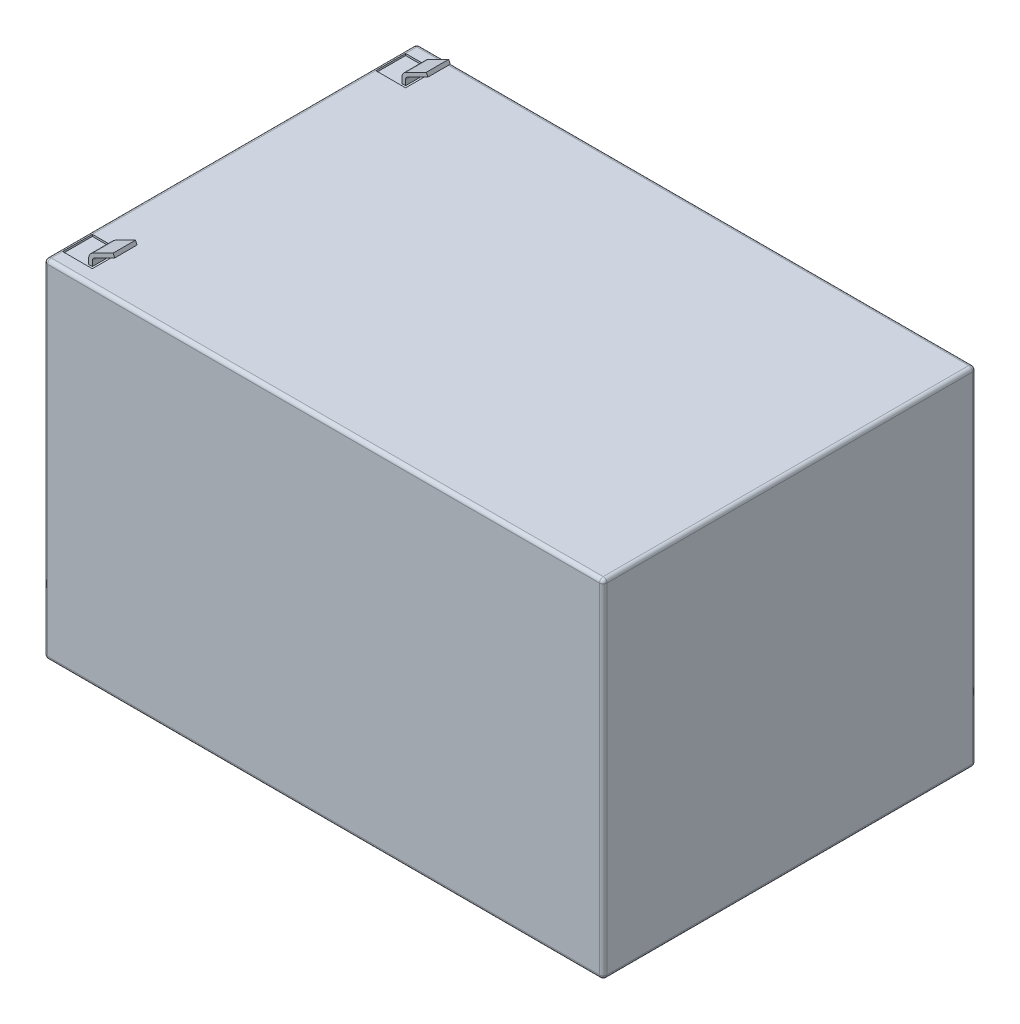
from build123d import *

# Parameters (mm, degrees)
SKETCH1_W           = 150
SKETCH1_H           = 100
BOSS_EXTRUDE1_DEPTH = 93
FILLET1_R           = 1
SKETCH2_W           = 8
SKETCH2_H           = 8
CUT_EXTRUDE1_DEPTH  = 0.5
EXTRUDE_THIN1_START = 1
EXTRUDE_THIN1_DEPTH = 6


with BuildPart() as part:
    # Sketch1 → Boss-Extrude1 (new body)
    with BuildSketch(Plane(origin=(0, 0, 0), x_dir=(1, 0, 0), z_dir=(0, 1, 0))):
        Rectangle(SKETCH1_W, SKETCH1_H)
    extrude(amount=BOSS_EXTRUDE1_DEPTH)

    # Fillet1
    fillet1_edges = [part.edges().sort_by_distance(p)[0] for p in [
        (-75, 93, 0),
        (0, 93, 50),
        (75, 93, 0),
        (0, 0, 50),
        (-75, 0, 0),
        (0, 0, -50),
        (75, 0, 0),
        (75, 46.5, 50),
        (-75, 46.5, 50),
        (-75, 46.5, -50),
        (75, 46.5, -50),
        (0, 93, -50),
    ]]
    fillet(fillet1_edges, radius=FILLET1_R)

    # Sketch2 → Cut-Extrude1 (cut)
    with BuildSketch(Plane(origin=(0, 93, 0), x_dir=(1, 0, 0), z_dir=(0, 1, 0))):
        with Locations((-70, 42)):
            Rectangle(SKETCH2_W, SKETCH2_H)
    cut_extrude1 = extrude(amount=-CUT_EXTRUDE1_DEPTH, mode=Mode.SUBTRACT)

    # Mirror1: Cut-Extrude1 across plane
    add(cut_extrude1.mirror(Plane.XY), mode=Mode.SUBTRACT)

    # Sketch3 → Extrude-Thin1 (add)
    with BuildSketch(Plane.XY.offset(-46).offset(EXTRUDE_THIN1_START)):
        with BuildLine():
            Line((-67, 92.5), (-67, 93.879345126))
            ThreePointArc((-67, 93.879345126), (-66.850650808, 94.405076238), (-66.447213595, 94.773772317))
            Line((-66.447213595, 94.773772317), (-61, 97.497379115))
            Line((-61, 97.497379115), (-61.447213595, 98.391806306))
            Line((-61.447213595, 98.391806306), (-66.894427191, 95.668199508))
            ThreePointArc((-66.894427191, 95.668199508), (-67.701301617, 94.93080735), (-68, 93.879345126))
            Line((-68, 93.879345126), (-68, 92.5))
            Line((-68, 92.5), (-67, 92.5))
        make_face()
    extrude_thin1 = extrude(amount=EXTRUDE_THIN1_DEPTH)

    # Mirror2: Extrude-Thin1 across plane
    add(extrude_thin1.mirror(Plane.XY))


solid = part.part
